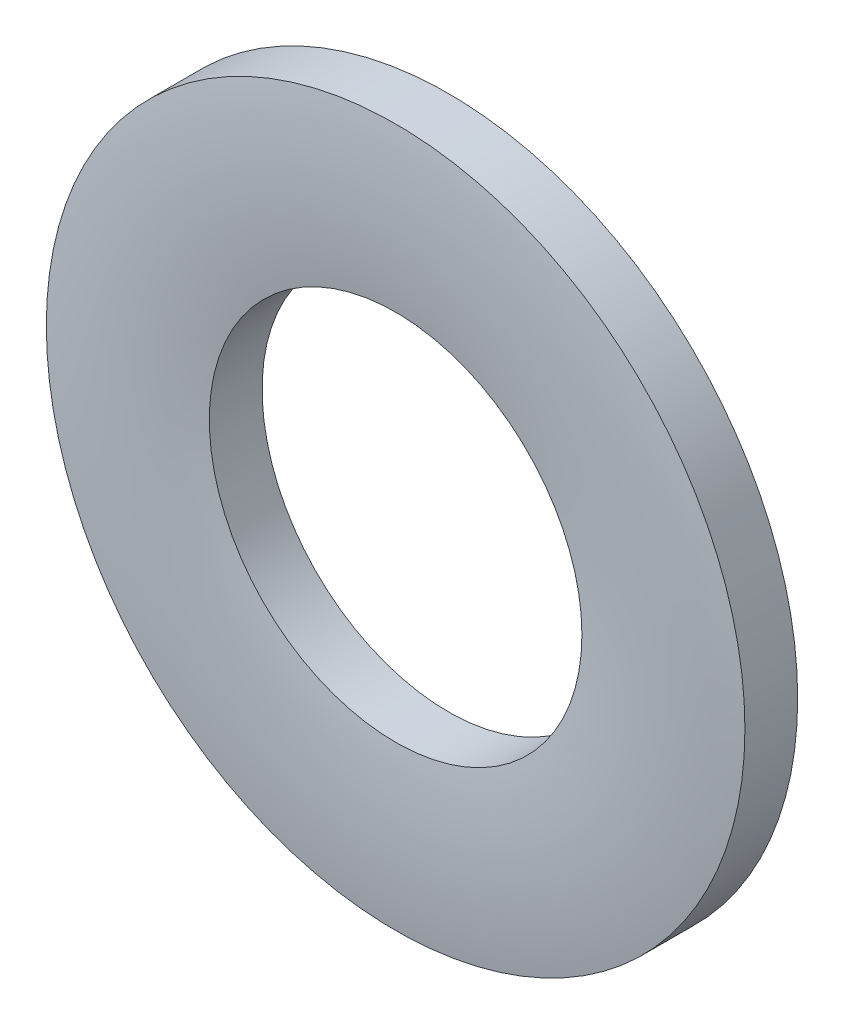
from build123d import *


with BuildPart() as part:
    # Sketch3 → Revolve1 (revolve)
    with BuildSketch(Plane(origin=(0, 0, 0), x_dir=(0, 0, -1), z_dir=(1, 0, 0)), mode=Mode.PRIVATE) as revolve1_sk:
        with BuildLine():
            Line((0.25, 3), (-0.20315, 3))
            ThreePointArc((-0.20315, 3), (-0.25, 2.3), (-0.20315, 1.6))
            Line((-0.20315, 1.6), (0.25, 1.6))
            Line((0.25, 1.6), (0.25, 3))
        make_face()
    revolve(revolve1_sk.sketch.rotate(Axis((0, 0, 0.25), (0, 0, -1)), 90), axis=Axis((0, 0, 0.25), (0, 0, -1)))


solid = part.part
